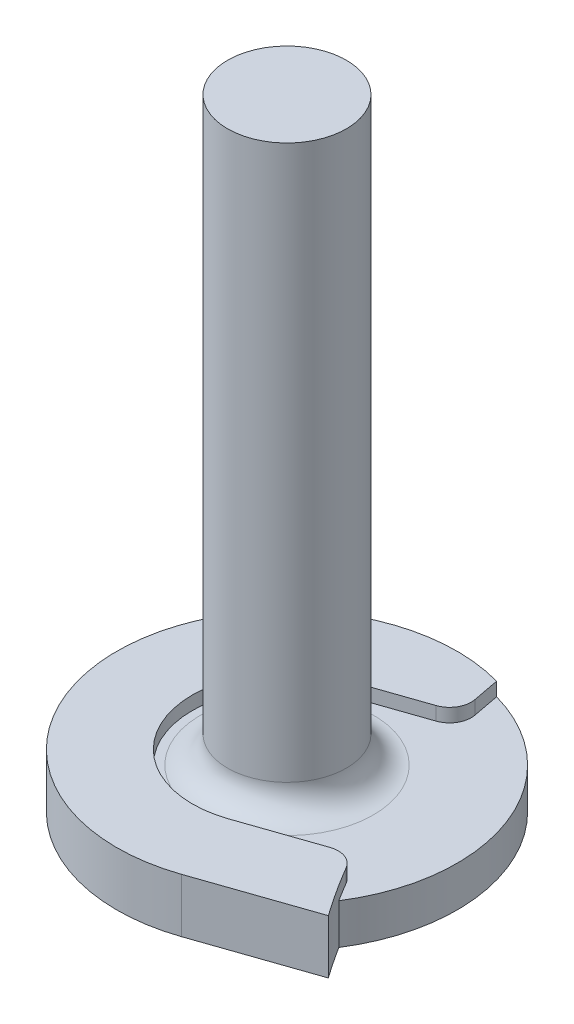
from build123d import *

# Parameters (mm, degrees)
SALIENTE_EXTRUIR1_DEPTH = 1.5
SKETCH1_R               = 2.2
BOSS_EXTRUDE1_DEPTH     = 21.500000004
FILLET1_R               = 1
BOSS_EXTRUDE2_DEPTH     = 0.5
SKETCH3_W               = 5
SKETCH3_H               = 5
CUT_EXTRUDE1_DEPTH      = 0.5


with BuildPart() as part:
    # Croquis1 → Saliente-Extruir1 (new body)
    with BuildSketch(Plane(origin=(0, 0, 0), x_dir=(1, 0, 0), z_dir=(0, 1, 0))):
        with BuildLine():
            Line((-28.127006156, 104.147953484), (-32.167734628, 102.755086599))
            ThreePointArc((-32.167734628, 102.755086599), (-38.119150085, 113.660211034), (-28.911320585, 105.320129452))
            ThreePointArc((-28.911320585, 105.320129452), (-28.527159067, 104.728691469), (-28.127006156, 104.147953484))
        make_face()
    extrude(amount=SALIENTE_EXTRUIR1_DEPTH)

    # Sketch1 → Boss-Extrude1 (add)
    with BuildSketch(Plane(origin=(0, 1.5, 0), x_dir=(1, 0, 0), z_dir=(0, 1, 0))):
        with Locations(Location((-34.220833362, 108.71115792, 0), (0, 0, 270))):
            Circle(SKETCH1_R)
    extrude(amount=BOSS_EXTRUDE1_DEPTH)

    # Fillet1
    fillet1_edges = [part.edges().sort_by_distance(p)[0] for p in [
        (-34.220833362, 1.5, -110.91115792),
    ]]
    fillet(fillet1_edges, radius=FILLET1_R)

    # Sketch2 → Boss-Extrude2 (add)
    with BuildSketch(Plane(origin=(0, 1.5, 0), x_dir=(1, 0, 0), z_dir=(0, 1, 0))):
        with BuildLine():
            Line((-28.127006156, 104.147953484), (-32.167734628, 102.755086599))
            ThreePointArc((-32.167734628, 102.755086599), (-40.517997562, 108.522152547), (-32.528643989, 114.779641679))
            Line((-32.528643989, 114.779641679), (-32.343112299, 113.800939457))
            ThreePointArc((-32.343112299, 113.800939457), (-32.430302685, 113.242017247), (-32.865386144, 112.880494657))
            Line((-32.865386144, 112.880494657), (-35.36144377, 112.020086432))
            ThreePointArc((-35.36144377, 112.020086432), (-37.529761874, 107.570547512), (-33.080222954, 105.402229408))
            Line((-33.080222954, 105.402229408), (-30.284555445, 106.36591522))
            ThreePointArc((-30.284555445, 106.36591522), (-29.746563901, 106.359998905), (-29.333985462, 106.014674515))
            ThreePointArc((-29.333985462, 106.014674515), (-28.750570862, 105.068333927), (-28.127006156, 104.147953484))
        make_face()
    extrude(amount=BOSS_EXTRUDE2_DEPTH)

    # Sketch3 → Cut-Extrude1 (cut)
    with BuildSketch(Plane.XZ):
        with Locations((-34.220833362, -108.71115792)):
            Rectangle(SKETCH3_W, SKETCH3_H)
    extrude(amount=-CUT_EXTRUDE1_DEPTH, mode=Mode.SUBTRACT)


solid = part.part
